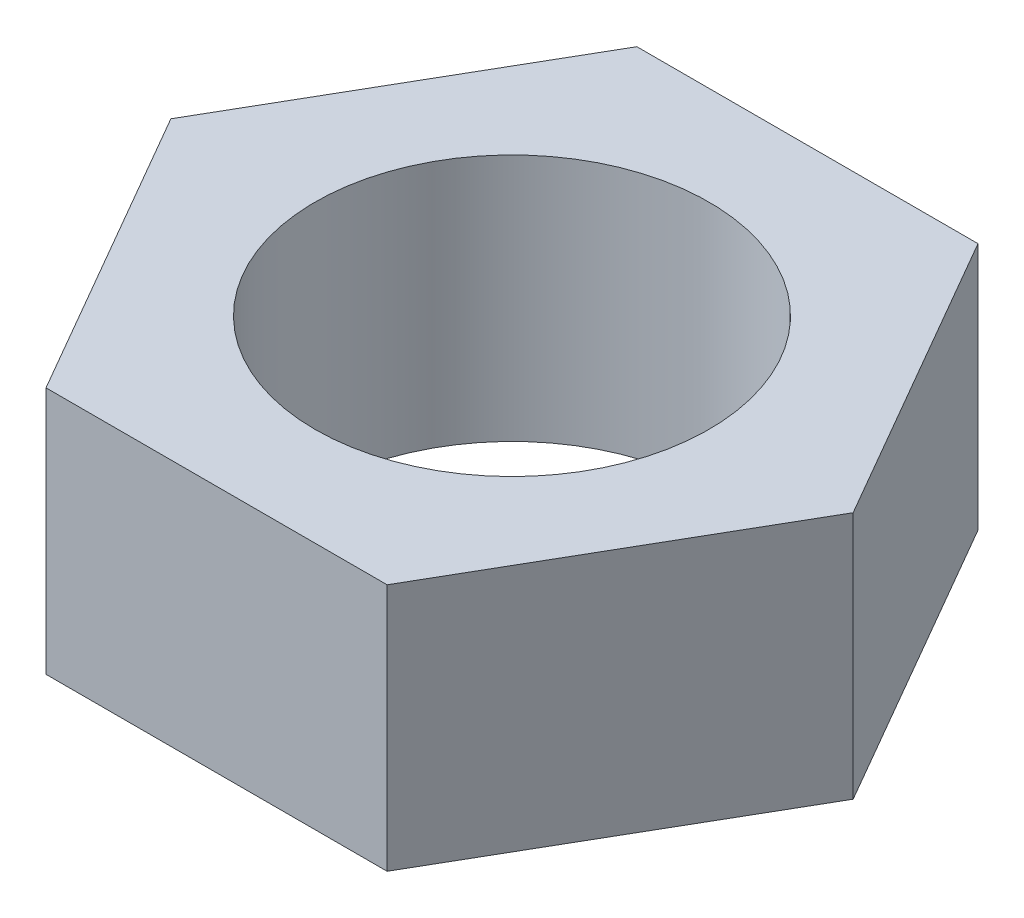
from build123d import *

# Parameters (mm, degrees)
SKETCH1_R           = 1.5875
BOSS_EXTRUDE1_DEPTH = 2


with BuildPart() as part:
    # Sketch1 → Boss-Extrude1 (new body)
    with BuildSketch(Plane(origin=(0, 0, 0), x_dir=(1, 0, 0), z_dir=(0, 1, 0))):
        Polygon((2.749630657, 0), (1.374815329, 2.38125), (-1.374815329, 2.38125), (-2.749630657, 0), (-1.374815329, -2.38125), (1.374815329, -2.38125), align=None)
        with Locations(Location((0, 0, 0), (0, 0, 270))):
            Circle(SKETCH1_R, mode=Mode.SUBTRACT)
    extrude(amount=BOSS_EXTRUDE1_DEPTH)


solid = part.part
